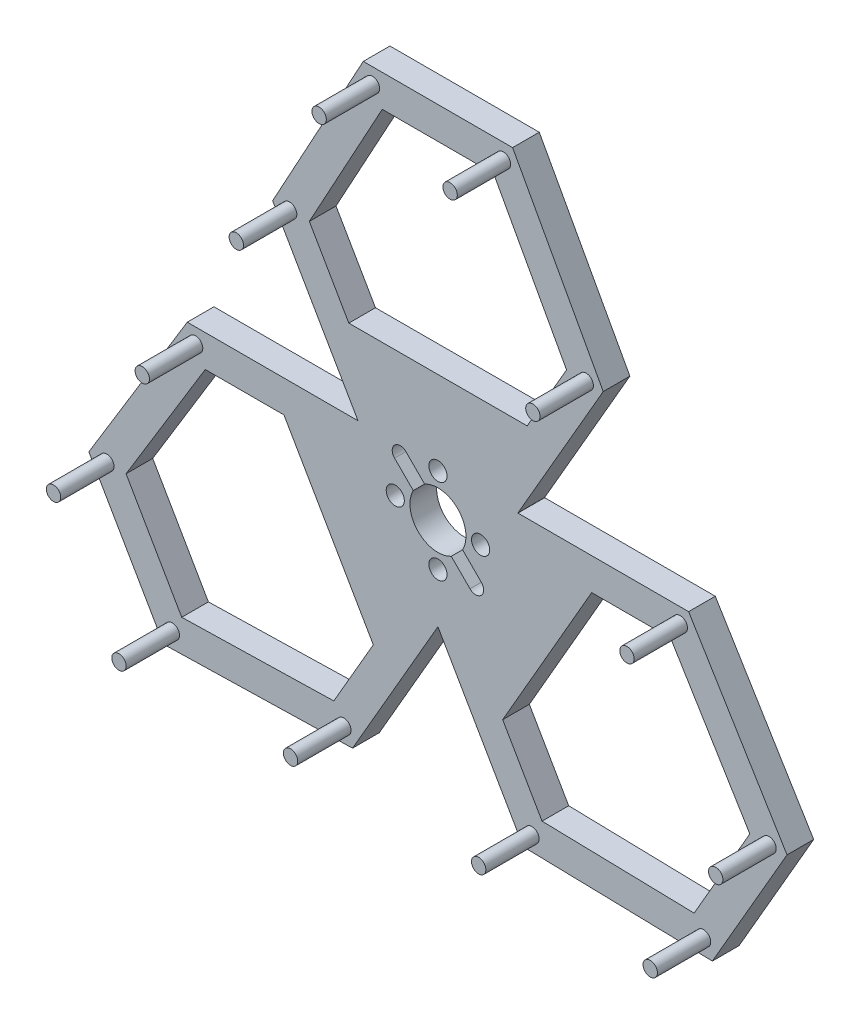
from build123d import *

# Parameters (mm, degrees)
BOSS_EXTRUDE1_DEPTH = 5
CUT_EXTRUDE1_DEPTH  = 95.158544522
CUT_EXTRUDE2_DEPTH  = 5
SKETCH5_R           = 1.35
BOSS_EXTRUDE2_DEPTH = 10
SKETCH6_R           = 1.7
CUT_EXTRUDE3_DEPTH  = 5


with BuildPart() as part:
    # Sketch1 → Boss-Extrude1 (new body)
    with BuildSketch(Plane.XY):
        Polygon((-30.995, 36.381727213), (-14, 67.5), (14, 67.5), (30.995, 36.381727213), (14.995, 8.668914292), (15, 8.660254038), (15.005, 8.651593784), (47.005, 8.651593784), (65.456714755, -21.625644347), (51.456714755, -45.874355653), (16.01, -45.033320997), (0.01, -17.320508076), (0, -17.320508076), (-0.01, -17.320508076), (-16.01, -45.033320997), (-51.456714755, -45.874355653), (-65.456714755, -21.625644347), (-47.005, 8.651593784), (-15.005, 8.651593784), (-15, 8.660254038), (-14.995, 8.668914292), align=None)
    extrude(amount=BOSS_EXTRUDE1_DEPTH)

    # Sketch2 → Cut-Extrude1 (cut, through all)
    with BuildSketch(Plane.XY.offset(5)):
        Polygon((-28.872149716, 2.651593784), (-12.118974925, -26.293867874), (-19.521225678, -39.114942267), (-48.040387098, -39.791608731), (-58.480737567, -21.708391269), (-43.63514651, 2.651593784), align=None)
        Polygon((-24.113920832, 36.463348484), (-16.71167008, 23.64227409), (16.732422435, 23.678218224), (24.113920832, 36.463348484), (10.440350469, 61.5), (-10.440350469, 61.5), align=None)
        Polygon((43.63514651, 2.651593784), (28.830645005, 2.651593784), (12.139727281, -26.329812008), (19.521225678, -39.114942267), (48.040387098, -39.791608731), (58.480737567, -21.708391269), align=None)
    extrude(amount=-CUT_EXTRUDE1_DEPTH, mode=Mode.SUBTRACT)

    # Sketch3 → Cut-Extrude2 (cut)
    with BuildSketch(Plane(origin=(0, 0, 0), x_dir=(-1, 0, 0), z_dir=(0, 0, -1))):
        with BuildLine():
            Line((6.01040764, 8.131727984), (2.496902196, 4.618222539))
            ThreePointArc((2.496902196, 4.618222539), (-3.712310601, 3.712310601), (-4.618222539, -2.496902196))
            Line((-4.618222539, -2.496902196), (-8.131727984, -6.01040764))
            ThreePointArc((-8.131727984, -6.01040764), (-8.131727984, -8.131727984), (-6.01040764, -8.131727984))
            Line((-6.01040764, -8.131727984), (-2.496902196, -4.618222539))
            ThreePointArc((-2.496902196, -4.618222539), (3.712310601, -3.712310601), (4.618222539, 2.496902196))
            Line((4.618222539, 2.496902196), (8.131727984, 6.01040764))
            ThreePointArc((8.131727984, 6.01040764), (8.131727984, 8.131727984), (6.01040764, 8.131727984))
        make_face()
    extrude(amount=-CUT_EXTRUDE2_DEPTH, mode=Mode.SUBTRACT)

    # Sketch5 → Boss-Extrude2 (add)
    with BuildSketch(Plane.XY.offset(5)):
        with Locations((-45.443044798, 5.870544436)):
            Circle(SKETCH5_R)
        with Locations((-62.08538883, -21.665632507)):
            Circle(SKETCH5_R)
        with Locations((-49.805684066, -42.93470506)):
            Circle(SKETCH5_R)
        with Locations((-17.637483295, -42.290100822)):
            Circle(SKETCH5_R)
        with Locations((27.80556106, 36.419560852)):
            Circle(SKETCH5_R)
        with Locations((12.279704321, 64.600342034)):
            Circle(SKETCH5_R)
        with Locations((-12.279705207, 64.600342034)):
            Circle(SKETCH5_R)
        with Locations((-27.805561947, 36.419560852)):
            Circle(SKETCH5_R)
        with Locations((17.637482409, -42.290100822)):
            Circle(SKETCH5_R)
        with Locations((49.80568318, -42.93470506)):
            Circle(SKETCH5_R)
        with Locations((62.085387944, -21.665632507)):
            Circle(SKETCH5_R)
        with Locations((45.443043912, 5.870544436)):
            Circle(SKETCH5_R)
    extrude(amount=BOSS_EXTRUDE2_DEPTH)

    # Sketch6 → Cut-Extrude3 (cut)
    with BuildSketch(Plane(origin=(0, 0, 0), x_dir=(-1, 0, 0), z_dir=(0, 0, -1))):
        with Locations((-8, 0)):
            Circle(SKETCH6_R)
        with Locations((0, -8)):
            Circle(SKETCH6_R)
        with Locations((8, 0)):
            Circle(SKETCH6_R)
        with Locations((0, 8)):
            Circle(SKETCH6_R)
    extrude(amount=-CUT_EXTRUDE3_DEPTH, mode=Mode.SUBTRACT)


solid = part.part
